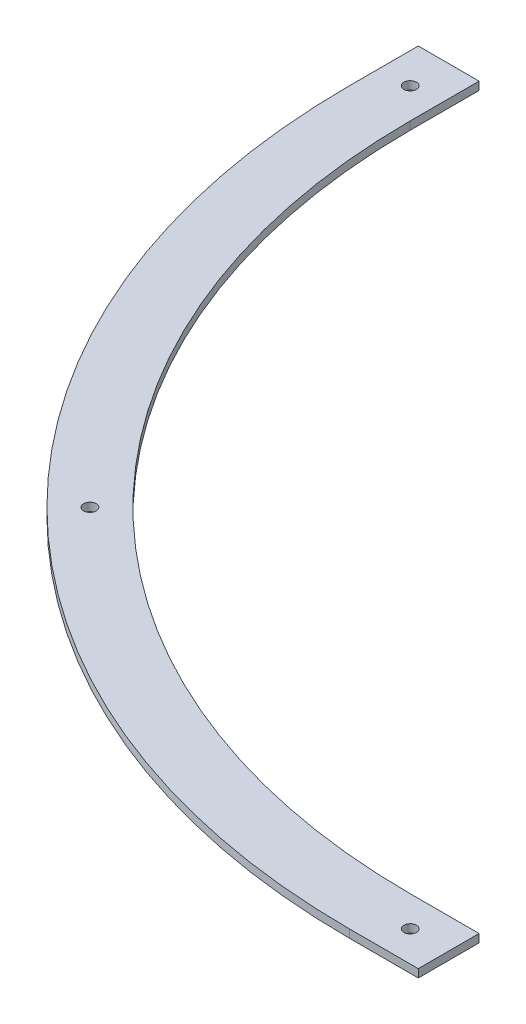
from build123d import *

# Parameters (mm, degrees)
SKETCH1_R           = 1.55
BOSS_EXTRUDE1_DEPTH = 2


with BuildPart() as part:
    # Sketch1 → Boss-Extrude1 (new body)
    with BuildSketch(Plane(origin=(0, 0, 0), x_dir=(1, 0, 0), z_dir=(0, 1, 0))):
        with BuildLine():
            Line((-90, 90), (-90, 107))
            Line((-90, 107), (-75, 107))
            Line((-75, 107), (-75, 90))
            ThreePointArc((-75, 90), (-26.672618896, -26.672618896), (90, -75))
            Line((90, -75), (107, -75))
            Line((107, -75), (107, -90))
            Line((107, -90), (90, -90))
            ThreePointArc((90, -90), (-37.279220614, -37.279220614), (-90, 90))
        make_face()
        with Locations(Location((-82.5, 97.5, 0), (0, 0, 270))):
            Circle(SKETCH1_R, mode=Mode.SUBTRACT)
        with Locations(Location((97.5, -82.5, 0), (0, 0, 270))):
            Circle(SKETCH1_R, mode=Mode.SUBTRACT)
        with Locations(Location((-31.975919755, -31.975919755, 0), (0, 0, 270))):
            Circle(SKETCH1_R, mode=Mode.SUBTRACT)
    extrude(amount=BOSS_EXTRUDE1_DEPTH)


solid = part.part
